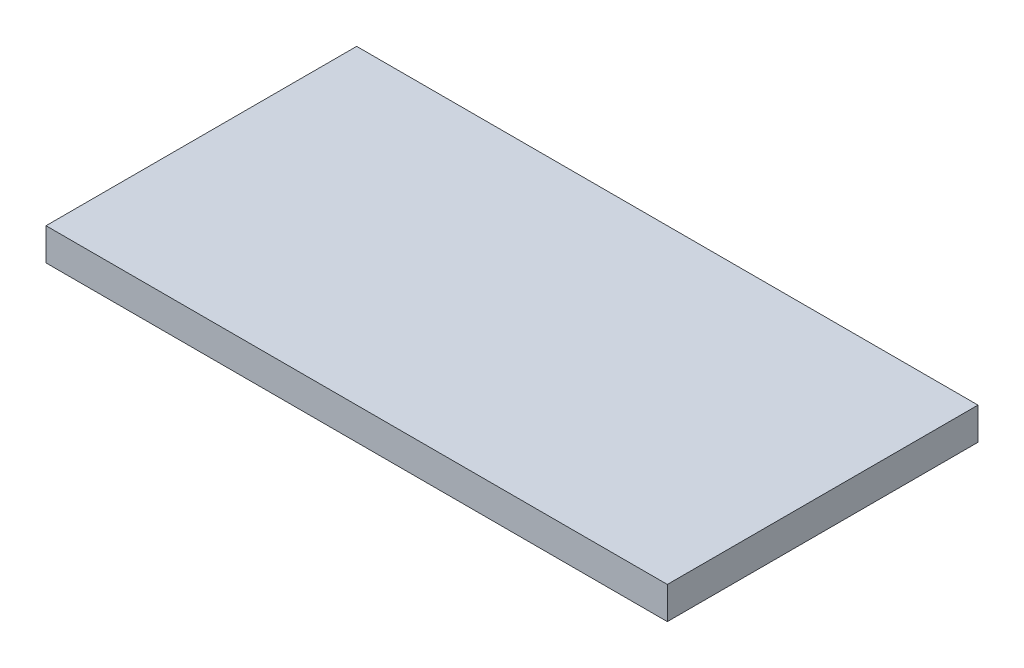
from build123d import *

# Parameters (mm, degrees)
SKETCH1_W                                  = 320
SKETCH1_H                                  = 160
BOSS_EXTRUDE1_DEPTH                        = 16.6
SKETCH1_3_W                                = 8.5
SKETCH1_3_H                                = 28
SKETCH1_3_W_2                              = 8
SKETCH1_3_H_2                              = 16
CUT_EXTRUDE1_DEPTH                         = 11.3
CUT_EXTRUDE2_DEPTH                         = 2
BOSS_EXTRUDE2_DEPTH                        = 2
SKETCH1_6_R                                = 2.1
CUT_EXTRUDE3_DEPTH                         = 6.75
MIRROR1_AT_THE_SECOND_PLANE_COPY_1_DEPTH   = 2
MIRROR1_AT_THE_SECOND_PLANE_COPY_2_SKETC_R = 2.1
MIRROR1_AT_THE_SECOND_PLANE_COPY_2_DEPTH   = 6.75
SKETCH2_R                                  = 1.65
BOSS_EXTRUDE4_DEPTH                        = 6.5
FILLET1_R                                  = 1.5


with BuildPart() as part:
    # Sketch1 → Boss-Extrude1 (new body)
    with BuildSketch(Plane(origin=(0, 0, 0), x_dir=(1, 0, 0), z_dir=(0, 1, 0))):
        Rectangle(SKETCH1_W, SKETCH1_H)
    extrude(amount=BOSS_EXTRUDE1_DEPTH)

    # Sketch1<3> → Cut-Extrude1 (cut)
    with BuildSketch(Plane(origin=(0, 0, 0), x_dir=(1, 0, 0), z_dir=(0, 1, 0))):
        with BuildLine():
            Line((130, -60), (-130, -60))
            ThreePointArc((-130, -60), (-137.071067812, -57.071067812), (-140, -50))
            Line((-140, -50), (-140, 50))
            ThreePointArc((-140, 50), (-137.071067812, 57.071067812), (-130, 60))
            Line((-130, 60), (130, 60))
            ThreePointArc((130, 60), (137.071067812, 57.071067812), (140, 50))
            Line((140, 50), (140, -50))
            ThreePointArc((140, -50), (137.071067812, -57.071067812), (130, -60))
        make_face()
        with Locations((91.25, 0)):
            Rectangle(SKETCH1_3_W, SKETCH1_3_H, mode=Mode.SUBTRACT)
        with Locations((-91.25, 0)):
            Rectangle(SKETCH1_3_W, SKETCH1_3_H, mode=Mode.SUBTRACT)
        with Locations((-24, -4)):
            Rectangle(SKETCH1_3_W_2, SKETCH1_3_H_2, mode=Mode.SUBTRACT)
    extrude(amount=CUT_EXTRUDE1_DEPTH, mode=Mode.SUBTRACT)

    # Sketch1<4> → Cut-Extrude2 (cut)
    with BuildSketch(Plane(origin=(0, 0, 0), x_dir=(1, 0, 0), z_dir=(0, 1, 0))):
        with BuildLine():
            Line((-151, -75), (151, -75))
            ThreePointArc((151, -75), (154.181980515, -73.681980515), (155.5, -70.5))
            Line((155.5, -70.5), (155.5, 70.5))
            ThreePointArc((155.5, 70.5), (154.181980515, 73.681980515), (151, 75))
            Line((151, 75), (-151, 75))
            ThreePointArc((-151, 75), (-154.181980515, 73.681980515), (-155.5, 70.5))
            Line((-155.5, 70.5), (-155.5, -70.5))
            ThreePointArc((-155.5, -70.5), (-154.181980515, -73.681980515), (-151, -75))
        make_face()
        with BuildLine():
            ThreePointArc((140, -50), (137.071067812, -57.071067812), (130, -60))
            Line((130, -60), (-130, -60))
            ThreePointArc((-130, -60), (-137.071067812, -57.071067812), (-140, -50))
            Line((-140, -50), (-140, 50))
            ThreePointArc((-140, 50), (-137.071067812, 57.071067812), (-130, 60))
            Line((-130, 60), (130, 60))
            ThreePointArc((130, 60), (137.071067812, 57.071067812), (140, 50))
            Line((140, 50), (140, -50))
        make_face(mode=Mode.SUBTRACT)
    extrude(amount=CUT_EXTRUDE2_DEPTH, mode=Mode.SUBTRACT)

    # Sketch1<5> → Boss-Extrude2 (add)
    with BuildSketch(Plane(origin=(0, 0, 0), x_dir=(1, 0, 0), z_dir=(0, 1, 0))):
        with BuildLine():
            Line((-152.5, 45.5), (-152.5, 39.5))
            ThreePointArc((-152.5, 39.5), (-148.5, 37.5), (-144.5, 39.5))
            Line((-144.5, 39.5), (-144.5, 45.5))
            ThreePointArc((-144.5, 45.5), (-148.5, 47.5), (-152.5, 45.5))
        make_face()
        with BuildLine():
            Line((-119.5, 72.3), (-125.5, 72.3))
            ThreePointArc((-125.5, 72.3), (-127.5, 68.3), (-125.5, 64.3))
            Line((-125.5, 64.3), (-119.5, 64.3))
            ThreePointArc((-119.5, 64.3), (-117.5, 68.3), (-119.5, 72.3))
        make_face()
        with BuildLine():
            Line((-34.5, 72.3), (-28.5, 72.3))
            ThreePointArc((-28.5, 72.3), (-26.5, 68.3), (-28.5, 64.3))
            Line((-28.5, 64.3), (-34.5, 64.3))
            ThreePointArc((-34.5, 64.3), (-36.5, 68.3), (-34.5, 72.3))
        make_face()
    boss_extrude2 = extrude(amount=BOSS_EXTRUDE2_DEPTH)

    # Sketch1<6> → Cut-Extrude3 (cut)
    with BuildSketch(Plane(origin=(0, 0, 0), x_dir=(1, 0, 0), z_dir=(0, 1, 0))):
        with Locations(Location((-148.5, 42.5, 0), (0, 0, 270))):
            Circle(SKETCH1_6_R)
        with Locations(Location((-122.5, 68.3, 0), (0, 0, 270))):
            Circle(SKETCH1_6_R)
        with Locations(Location((-31.5, 68.3, 0), (0, 0, 270))):
            Circle(SKETCH1_6_R)
    cut_extrude3 = extrude(amount=CUT_EXTRUDE3_DEPTH, mode=Mode.SUBTRACT)

    # Mirror1: Boss-Extrude2, Cut-Extrude3 across plane
    add(boss_extrude2.mirror(Plane.XY))
    add(cut_extrude3.mirror(Plane.XY), mode=Mode.SUBTRACT)

    # Mirror1 at the second plane: Boss-Extrude2, Cut-Extrude3 across plane
    add(boss_extrude2.mirror(Plane(origin=(0, 0, 0), x_dir=(0, 0, 1), z_dir=(1, 0, 0))))
    add(cut_extrude3.mirror(Plane(origin=(0, 0, 0), x_dir=(0, 0, 1), z_dir=(1, 0, 0))), mode=Mode.SUBTRACT)

    # Mirror1 at the second plane copy 1 sketc → Mirror1 at the second plane copy 1 (add)
    with BuildSketch(Plane(origin=(0, 0, 0), x_dir=(-1, 0, 0), z_dir=(0, 1, 0))):
        with BuildLine():
            Line((-152.5, 45.5), (-152.5, 39.5))
            ThreePointArc((-152.5, 39.5), (-148.5, 37.5), (-144.5, 39.5))
            Line((-144.5, 39.5), (-144.5, 45.5))
            ThreePointArc((-144.5, 45.5), (-148.5, 47.5), (-152.5, 45.5))
        make_face()
        with BuildLine():
            Line((-119.5, 72.3), (-125.5, 72.3))
            ThreePointArc((-125.5, 72.3), (-127.5, 68.3), (-125.5, 64.3))
            Line((-125.5, 64.3), (-119.5, 64.3))
            ThreePointArc((-119.5, 64.3), (-117.5, 68.3), (-119.5, 72.3))
        make_face()
        with BuildLine():
            Line((-34.5, 72.3), (-28.5, 72.3))
            ThreePointArc((-28.5, 72.3), (-26.5, 68.3), (-28.5, 64.3))
            Line((-28.5, 64.3), (-34.5, 64.3))
            ThreePointArc((-34.5, 64.3), (-36.5, 68.3), (-34.5, 72.3))
        make_face()
    extrude(amount=MIRROR1_AT_THE_SECOND_PLANE_COPY_1_DEPTH)

    # Mirror1 at the second plane copy 2 sketc → Mirror1 at the second plane copy 2 (cut)
    with BuildSketch(Plane(origin=(0, 0, 0), x_dir=(-1, 0, 0), z_dir=(0, 1, 0))):
        with Locations(Location((-148.5, 42.5, 0), (0, 0, 270))):
            Circle(MIRROR1_AT_THE_SECOND_PLANE_COPY_2_SKETC_R)
        with Locations(Location((-122.5, 68.3, 0), (0, 0, 270))):
            Circle(MIRROR1_AT_THE_SECOND_PLANE_COPY_2_SKETC_R)
        with Locations(Location((-31.5, 68.3, 0), (0, 0, 270))):
            Circle(MIRROR1_AT_THE_SECOND_PLANE_COPY_2_SKETC_R)
    extrude(amount=MIRROR1_AT_THE_SECOND_PLANE_COPY_2_DEPTH, mode=Mode.SUBTRACT)

    # Sketch2 → Boss-Extrude4 (add)
    with BuildSketch(Plane.XZ.offset(-2)):
        with Locations(Location((70.2, 69, 0), (0, 0, 90))):
            Circle(SKETCH2_R)
    extrude(amount=BOSS_EXTRUDE4_DEPTH)

    # Fillet1
    fillet1_edges = [part.edges().sort_by_distance(p)[0] for p in [
        (70.2, -4.5, 67.35),
    ]]
    fillet(fillet1_edges, radius=FILLET1_R)


solid = part.part
